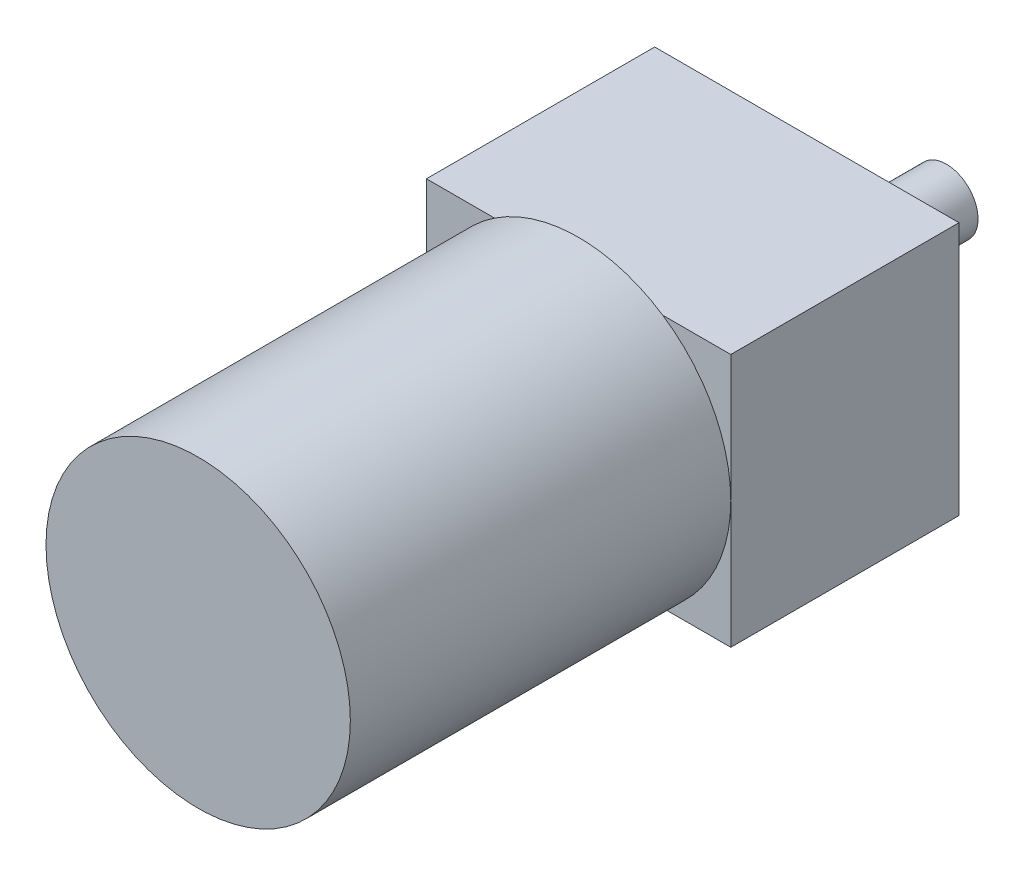
from build123d import *

# Parameters (mm, degrees)
SKETCH1_W           = 12
SKETCH1_H           = 10
BOSS_EXTRUDE1_DEPTH = 9
SKETCH2_R           = 6
BOSS_EXTRUDE2_DEPTH = 15
SKETCH3_R           = 2
BOSS_EXTRUDE3_DEPTH = 1
SKETCH4_R           = 1.25
BOSS_EXTRUDE4_DEPTH = 4.5


with BuildPart() as part:
    # Sketch1 → Boss-Extrude1 (new body)
    with BuildSketch(Plane.XY):
        with Locations((6, -5)):
            Rectangle(SKETCH1_W, SKETCH1_H)
    extrude(amount=BOSS_EXTRUDE1_DEPTH)

    # Sketch2 → Boss-Extrude2 (add)
    with BuildSketch(Plane.XY.offset(9)):
        with Locations((6, -5)):
            Circle(SKETCH2_R)
    extrude(amount=BOSS_EXTRUDE2_DEPTH)

    # Sketch3 → Boss-Extrude3 (add)
    with BuildSketch(Plane(origin=(0, 0, 0), x_dir=(-1, 0, 0), z_dir=(0, 0, -1))):
        with Locations((-6, -5)):
            Circle(SKETCH3_R)
    extrude(amount=BOSS_EXTRUDE3_DEPTH)

    # Sketch4 → Boss-Extrude4 (add)
    with BuildSketch(Plane(origin=(0, 0, -1), x_dir=(-1, 0, 0), z_dir=(0, 0, -1))):
        with Locations((-6, -5)):
            Circle(SKETCH4_R)
    extrude(amount=BOSS_EXTRUDE4_DEPTH)


solid = part.part
